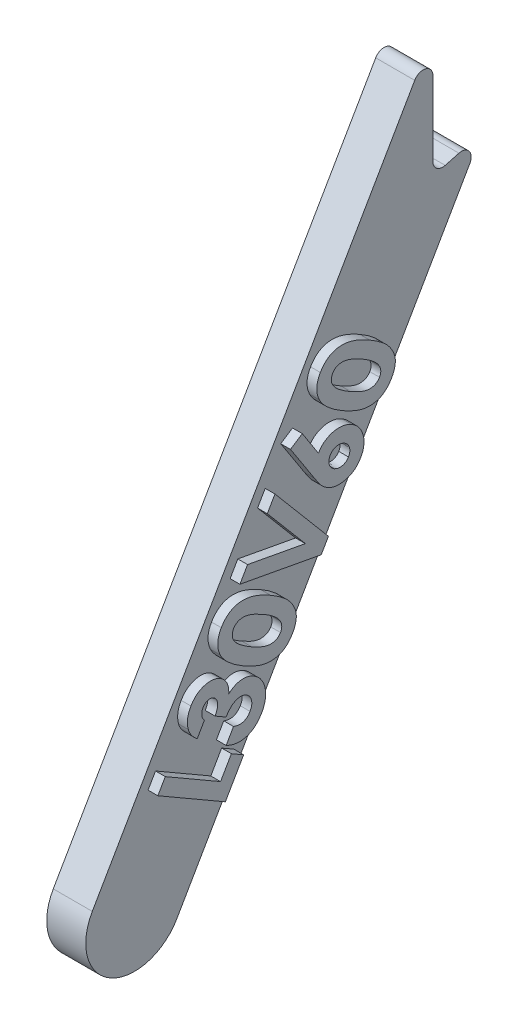
from build123d import *

# Parameters (mm, degrees)
BOSS_EXTRUDE1_DEPTH = 2
FILLET1_R           = 0.5
BOSS_EXTRUDE2_DEPTH = 0.5


with BuildPart() as part:
    # Sketch1 → Boss-Extrude1 (new body)
    with BuildSketch(Plane(origin=(0, 0, 0), x_dir=(0, 0, -1), z_dir=(1, 0, 0))):
        with BuildLine():
            Line((-2.165063509, 1.25), (15.297036272, 31.495244028))
            Line((15.297036272, 31.495244028), (15.297036272, 25.806989001))
            ThreePointArc((15.297036272, 25.806989001), (15.492655558, 25.410312331), (15.926445795, 25.324026088))
            Line((15.926445795, 25.324026088), (17.796953114, 25.825227013))
            Line((17.796953114, 25.825227013), (2.165063509, -1.25))
            ThreePointArc((2.165063509, -1.25), (-1.25, -2.165063509), (-2.165063509, 1.25))
        make_face()
    extrude(amount=BOSS_EXTRUDE1_DEPTH)

    # Fillet1
    fillet1_edges = [part.edges().sort_by_distance(p)[0] for p in [
        (1, 31.495244028, -15.297036272),
        (1, 25.825227013, -17.796953114),
    ]]
    fillet(fillet1_edges, radius=FILLET1_R)

    # Sketch2 → Boss-Extrude2 (add)
    # profile 1 of 6: a face of its own
    with BuildSketch(Plane(origin=(2, 0, 0), x_dir=(0, 0, -1), z_dir=(1, 0, 0))):
        Polygon((0.696036681, 5.202812128), (1.076645655, 5.861465975), (3.91078027, 4.224446744), (4.466068732, 5.185183923), (5.09427386, 4.822203154), (4.158376424, 3.202812128), align=None)
    # profile 2 of 6: a face of its own
    with BuildSketch(Plane(origin=(2, 0, 0), x_dir=(0, 0, -1), z_dir=(1, 0, 0))):
        with BuildLine():
            Line((3.081453347, 7.361009276), (2.716068732, 6.727996456))
            add(Edge.make_bspline(
                [(2.716068732, 6.727996456), (2.687395864, 6.750539351), (2.631081269, 6.794814449), (2.554308544, 6.867288344), (2.484888021, 6.942170767), (2.422950426, 7.019472666), (2.370112901, 7.100370796), (2.323683149, 7.18286105), (2.286667195, 7.269285762), (2.267927843, 7.328786726), (2.258536681, 7.35860543)],
                knots=[0, 0, 0, 0, 1.103452488, 2.167222367, 3.19120776, 4.192378773, 5.16097021, 6.112613477, 7.05414269, 8, 8, 8, 8], degree=3))
            add(Edge.make_bspline(
                [(2.258536681, 7.35860543), (2.24804942, 7.400365382), (2.227386734, 7.482643561), (2.211743441, 7.608133284), (2.207969235, 7.732747429), (2.219120269, 7.856432906), (2.240997268, 7.979734282), (2.278892765, 8.101129201), (2.327459355, 8.222861836), (2.369881131, 8.300512973), (2.391549501, 8.340175943)],
                knots=[0, 0, 0, 0, 1.013588041, 1.997037231, 2.972725098, 3.945242236, 4.917820447, 5.917146435, 6.936111432, 8, 8, 8, 8], degree=3))
            add(Edge.make_bspline(
                [(2.391549501, 8.340175943), (2.412317219, 8.374491348), (2.453230795, 8.442094632), (2.524053853, 8.535264546), (2.601419549, 8.618846221), (2.68395814, 8.69385256), (2.772911092, 8.759214724), (2.867562627, 8.815505579), (2.968634105, 8.862134091), (3.07406509, 8.899405848), (3.181698163, 8.926448983), (3.288427763, 8.943451759), (3.393359932, 8.95023658), (3.496060434, 8.945612891), (3.59668023, 8.929004317), (3.695397624, 8.902783721), (3.792151308, 8.865040514), (3.853404266, 8.832014733), (3.884337963, 8.815336199)],
                knots=[0, 0, 0, 0, 1.104545616, 2.17601713, 3.217554495, 4.238772093, 5.244036151, 6.253681051, 7.267741271, 8.305789213, 9.330262856, 10.321121269, 11.279587532, 12.22256057, 13.146856727, 14.084011555, 15.032396042, 16, 16, 16, 16], degree=3))
            add(Edge.make_bspline(
                [(3.884337963, 8.815336199), (3.921158498, 8.792079625), (3.994004027, 8.746068957), (4.089489226, 8.658893831), (4.170077627, 8.558638224), (4.236117514, 8.446338107), (4.286879341, 8.323477855), (4.319641819, 8.190387749), (4.335020956, 8.048575245), (4.331602387, 7.951575379), (4.329850783, 7.901874661)],
                knots=[0, 0, 0, 0, 0.971746073, 1.922496671, 2.873303474, 3.836562037, 4.82416312, 5.833158122, 6.889755202, 8, 8, 8, 8], degree=3))
            add(Edge.make_bspline(
                [(4.329850783, 7.901874661), (4.352791055, 7.922789366), (4.398123756, 7.964119306), (4.470286326, 8.019186463), (4.544109417, 8.067574828), (4.620010548, 8.108743324), (4.697786339, 8.143096812), (4.777437434, 8.171595687), (4.859282086, 8.192394363), (4.94270875, 8.205713754), (5.026543485, 8.213279093), (5.110144046, 8.212885682), (5.193351173, 8.207029755), (5.275506111, 8.192093091), (5.357318625, 8.171298432), (5.438388031, 8.142862622), (5.519354286, 8.108130269), (5.571272018, 8.079159), (5.597478988, 8.064534917)],
                knots=[0, 0, 0, 0, 1.081367641, 2.136910875, 3.159224907, 4.154618218, 5.142191382, 6.119535833, 7.09927064, 8.080110121, 9.060993763, 10.028986273, 10.990558503, 11.963772466, 12.934490777, 13.929405293, 14.954807702, 16, 16, 16, 16], degree=3))
            add(Edge.make_bspline(
                [(5.597478988, 8.064534917), (5.635139894, 8.041547436), (5.709184787, 7.996351879), (5.809996552, 7.915684829), (5.900887054, 7.827776512), (5.980743436, 7.731032589), (6.049148266, 7.626023535), (6.107054923, 7.513219345), (6.154536513, 7.392152343), (6.190806989, 7.264144846), (6.216089369, 7.13226796), (6.226081671, 6.998744286), (6.224034108, 6.865616949), (6.207697129, 6.732187937), (6.177601468, 6.599000757), (6.13514279, 6.465202392), (6.077881449, 6.331885316), (6.030875776, 6.245535286), (6.006934117, 6.201554148)],
                knots=[0, 0, 0, 0, 0.993515244, 1.953344675, 2.902602536, 3.839024727, 4.773975407, 5.721609641, 6.691858124, 7.699765937, 8.716264944, 9.712548052, 10.711935842, 11.712410712, 12.73615555, 13.785073901, 14.871859456, 16, 16, 16, 16], degree=3))
            add(Edge.make_bspline(
                [(6.006934117, 6.201554148), (5.982213617, 6.161056096), (5.933824189, 6.081782713), (5.851502595, 5.972387285), (5.763560608, 5.873890483), (5.668068859, 5.788088268), (5.568016078, 5.71173516), (5.460276831, 5.648524704), (5.347149089, 5.594957911), (5.227657689, 5.554533232), (5.104772254, 5.525658974), (4.979382399, 5.509409138), (4.8524025, 5.506403226), (4.723475959, 5.515828267), (4.59332375, 5.539931193), (4.46123732, 5.575064029), (4.327791366, 5.62420595), (4.240594017, 5.665850797), (4.196036681, 5.687131071)],
                knots=[0, 0, 0, 0, 1.082497812, 2.11894792, 3.120451818, 4.091599749, 5.045134628, 5.988263042, 6.937421913, 7.897580193, 8.861794763, 9.81462771, 10.778225281, 11.756447433, 12.759823874, 13.795053911, 14.873285434, 16, 16, 16, 16], degree=3))
            Line((4.196036681, 5.687131071), (4.573440527, 6.339374661))
            add(Edge.make_bspline(
                [(4.573440527, 6.339374661), (4.59735212, 6.330435346), (4.643614845, 6.313140094), (4.713469753, 6.294258484), (4.780439096, 6.279056022), (4.845428359, 6.27167041), (4.907565333, 6.267596655), (4.967425161, 6.2711851), (5.024932667, 6.279673639), (5.097715259, 6.299109352), (5.183518676, 6.336170603), (5.276260535, 6.400734528), (5.35790176, 6.484616226), (5.400204468, 6.551639896), (5.421998219, 6.586169533)],
                knots=[0, 0, 0, 0, 0.939597167, 1.817876585, 2.662916536, 3.465737634, 4.224184202, 4.953162039, 5.669621718, 6.361554499, 7.722932731, 9.087257403, 10.49939664, 12, 12, 12, 12], degree=3))
            add(Edge.make_bspline(
                [(5.421998219, 6.586169533), (5.441664647, 6.624268625), (5.479738039, 6.698026893), (5.510945142, 6.817233107), (5.51663471, 6.936992073), (5.500720443, 7.035560385), (5.477551816, 7.111694761), (5.455056295, 7.166047958), (5.428584348, 7.21740058), (5.396443524, 7.264628699), (5.359135048, 7.308177572), (5.317471444, 7.348404391), (5.270582518, 7.384735472), (5.236573764, 7.405655788), (5.21927386, 7.416297738)],
                knots=[0, 0, 0, 0, 1.615365577, 3.12728093, 4.611659855, 6.112397569, 6.871762481, 7.613506319, 8.330846268, 9.049815329, 9.765309206, 10.492928571, 11.233368272, 12, 12, 12, 12], degree=3))
            add(Edge.make_bspline(
                [(5.21927386, 7.416297738), (5.199720917, 7.426629643), (5.161026413, 7.447076077), (5.099704633, 7.4696573), (5.03691622, 7.483886894), (4.972696746, 7.491471777), (4.907000197, 7.490539699), (4.839924098, 7.481272275), (4.771421541, 7.465195306), (4.702040582, 7.441291257), (4.632914163, 7.408837432), (4.564576067, 7.368990355), (4.498533305, 7.319441625), (4.434611736, 7.261129222), (4.370931937, 7.19565876), (4.310209159, 7.120417408), (4.250879588, 7.03713654), (4.214119269, 6.977421978), (4.195235399, 6.946746456)],
                knots=[0, 0, 0, 0, 0.844174053, 1.670587152, 2.48736984, 3.298653107, 4.135394815, 4.989682768, 5.880657108, 6.819647913, 7.787413102, 8.793626458, 9.836422791, 10.934605363, 12.096405794, 13.321877204, 14.624241476, 16, 16, 16, 16], degree=3))
            Line((4.195235399, 6.946746456), (3.630331553, 7.272868251))
            add(Edge.make_bspline(
                [(3.630331553, 7.272868251), (3.648505471, 7.311894174), (3.682559775, 7.385020981), (3.722146838, 7.490781197), (3.748547324, 7.584022161), (3.762633517, 7.666601294), (3.763931391, 7.741250038), (3.757236354, 7.811168422), (3.739939032, 7.877058895), (3.71522021, 7.939162881), (3.682746578, 7.995553583), (3.643476608, 8.045267067), (3.598824993, 8.08875872), (3.563739622, 8.110536868), (3.546196937, 8.121425943)],
                knots=[0, 0, 0, 0, 1.635208655, 3.064055274, 4.285189192, 5.312893128, 6.23658106, 7.114072127, 7.973060155, 8.815402483, 9.647411949, 10.435105952, 11.217552976, 12, 12, 12, 12], degree=3))
            add(Edge.make_bspline(
                [(3.546196937, 8.121425943), (3.522842606, 8.133450686), (3.477462007, 8.156816377), (3.403142552, 8.173431316), (3.327996066, 8.175693961), (3.253493412, 8.159458862), (3.181652293, 8.130325472), (3.116794953, 8.084862232), (3.058186604, 8.026131812), (3.028183467, 7.978162631), (3.012543091, 7.953156712)],
                knots=[0, 0, 0, 0, 1.002389715, 1.947777773, 2.889117042, 3.86011462, 4.846084409, 5.839192295, 6.87358967, 8, 8, 8, 8], degree=3))
            add(Edge.make_bspline(
                [(3.012543091, 7.953156712), (3.00028504, 7.929457908), (2.975973322, 7.882455438), (2.953211717, 7.80601618), (2.944956232, 7.726596398), (2.947816851, 7.646038071), (2.963884654, 7.567099997), (2.991590235, 7.492364004), (3.029922859, 7.422352014), (3.064165452, 7.38158907), (3.081453347, 7.361009276)],
                knots=[0, 0, 0, 0, 1.003070024, 1.989415536, 2.981129302, 3.997619589, 5.013313644, 5.999659156, 6.990097405, 8, 8, 8, 8], degree=3))
        make_face()
    # profile 3 of 6: a face of its own
    with BuildSketch(Plane(origin=(2, 0, 0), x_dir=(0, 0, -1), z_dir=(1, 0, 0))):
        with BuildLine():
            add(Edge.make_bspline(
                [(3.948440527, 11.037261821), (3.967070964, 11.067918482), (4.003714257, 11.128215562), (4.063605599, 11.213791467), (4.129328019, 11.291234519), (4.196912463, 11.364177436), (4.270039996, 11.428817957), (4.346887328, 11.486829964), (4.426767017, 11.539350801), (4.51151078, 11.584026741), (4.599557408, 11.623066815), (4.692071927, 11.653041773), (4.788100918, 11.676885258), (4.888208508, 11.691543692), (4.992085658, 11.699645077), (5.099708052, 11.700223282), (5.211340252, 11.693853785), (5.327277028, 11.679292829), (5.448508993, 11.655661316), (5.57578543, 11.62250217), (5.710261931, 11.579999306), (5.850803949, 11.525743329), (5.998309625, 11.462325533), (6.1523397, 11.389255459), (6.312875517, 11.305692443), (6.420857496, 11.244345849), (6.476485399, 11.212742591)],
                knots=[0, 0, 0, 0, 0.897945687, 1.766125294, 2.611054601, 3.438745458, 4.253288671, 5.050272801, 5.847705525, 6.643342353, 7.445776631, 8.255558727, 9.074480649, 9.919833108, 10.784917775, 11.680869907, 12.611765167, 13.582045211, 14.603519984, 15.701372416, 16.872820259, 18.131942509, 19.470767641, 20.891370698, 22.39856122, 24, 24, 24, 24], degree=3))
            add(Edge.make_bspline(
                [(6.476485399, 11.212742591), (6.532289502, 11.18002821), (6.640639838, 11.116509331), (6.794306383, 11.017351378), (6.936830323, 10.92106389), (7.065875811, 10.823787014), (7.183151997, 10.727753211), (7.288424129, 10.632703576), (7.381009592, 10.53794593), (7.461615205, 10.443792102), (7.531687583, 10.349989963), (7.593636711, 10.257396942), (7.646655614, 10.16450623), (7.692612359, 10.072787257), (7.730014554, 9.980997422), (7.757575166, 9.889314431), (7.779279122, 9.7984966), (7.791017001, 9.707468847), (7.795175111, 9.616324518), (7.790996002, 9.524369517), (7.77902846, 9.431613647), (7.758604387, 9.337899333), (7.730498204, 9.243352338), (7.694154631, 9.147455205), (7.649411411, 9.050935238), (7.614428921, 8.987646001), (7.596677706, 8.955531052)],
                knots=[0, 0, 0, 0, 1.627138575, 3.159284035, 4.599955029, 5.953233711, 7.223102846, 8.412295733, 9.519440672, 10.553632078, 11.527938494, 12.463474405, 13.35441623, 14.216852656, 15.042868795, 15.844164156, 16.623290634, 17.389238113, 18.149268111, 18.916010952, 19.701945684, 20.499287075, 21.326313799, 22.181178389, 23.077072736, 24, 24, 24, 24], degree=3))
            add(Edge.make_bspline(
                [(7.596677706, 8.955531052), (7.577551297, 8.923779074), (7.540221278, 8.86180707), (7.478793185, 8.77420795), (7.413392725, 8.69469319), (7.344790925, 8.621623269), (7.272711226, 8.556381932), (7.198117222, 8.496594529), (7.118263131, 8.446983341), (7.036321823, 8.40201113), (6.95035796, 8.365311521), (6.860526977, 8.335562246), (6.767149073, 8.312066347), (6.669447141, 8.297290501), (6.568553998, 8.288609772), (6.463596602, 8.285751394), (6.354992816, 8.292181008), (6.241681128, 8.303770968), (6.123000069, 8.324934475), (5.998059784, 8.356484146), (5.866253331, 8.398522109), (5.727597792, 8.451353411), (5.580858944, 8.51245937), (5.428297547, 8.5861837), (5.267899559, 8.668672643), (5.16028854, 8.72995752), (5.104690527, 8.761620796)],
                knots=[0, 0, 0, 0, 0.938650759, 1.832013983, 2.706846486, 3.544289129, 4.367929325, 5.167721864, 5.961541433, 6.745470318, 7.53335876, 8.32486903, 9.140300817, 9.968871211, 10.824477765, 11.704135634, 12.625366009, 13.57785821, 14.587718162, 15.675505246, 16.839365094, 18.089553933, 19.432634678, 20.863865142, 22.379693198, 24, 24, 24, 24], degree=3))
            add(Edge.make_bspline(
                [(5.104690527, 8.761620796), (5.028437458, 8.806914173), (4.881290076, 8.894317893), (4.674940898, 9.031158142), (4.490688628, 9.168471421), (4.32771187, 9.304866908), (4.186289039, 9.441280917), (4.067048617, 9.577779623), (3.968086633, 9.713671493), (3.918030231, 9.808808892), (3.893953347, 9.854569514)],
                knots=[0, 0, 0, 0, 1.287312753, 2.484158368, 3.592255041, 4.621348856, 5.567290122, 6.44119351, 7.250221727, 8, 8, 8, 8], degree=3))
            add(Edge.make_bspline(
                [(3.893953347, 9.854569514), (3.872471542, 9.904069487), (3.830436129, 10.000930609), (3.788519695, 10.151197824), (3.76689947, 10.300902864), (3.762948993, 10.450131908), (3.780755353, 10.598933407), (3.815995021, 10.747343177), (3.871628899, 10.89513928), (3.922463473, 10.989197159), (3.948440527, 11.037261821)],
                knots=[0, 0, 0, 0, 1.047685645, 2.05010224, 3.020483215, 3.980916167, 4.942134176, 5.92407839, 6.939180083, 8, 8, 8, 8], degree=3))
        make_face()
        with BuildLine():
            add(Edge.make_bspline(
                [(4.584658476, 10.691909257), (4.570324139, 10.664017166), (4.542012103, 10.608926937), (4.516836478, 10.519258986), (4.50924412, 10.426439381), (4.516776108, 10.330378236), (4.545989961, 10.230623591), (4.600101652, 10.129195702), (4.677064581, 10.024441207), (4.758342428, 9.936924908), (4.835983746, 9.86422478), (4.905349645, 9.806985846), (4.982466411, 9.746363282), (5.069133126, 9.68429987), (5.164494272, 9.619346216), (5.268695264, 9.552461582), (5.380885499, 9.482101227), (5.459772261, 9.436579089), (5.50052386, 9.413063103)],
                knots=[0, 0, 0, 0, 0.858098385, 1.6948473, 2.532716597, 3.399764107, 4.321997128, 5.360041158, 6.534607272, 7.876701611, 8.627836606, 9.449033435, 10.34097936, 11.316376895, 12.370333617, 13.503553264, 14.710376797, 16, 16, 16, 16], degree=3))
            add(Edge.make_bspline(
                [(5.50052386, 9.413063103), (5.553447726, 9.382997679), (5.65488074, 9.325374779), (5.804405816, 9.24910927), (5.943791012, 9.184568871), (6.073457075, 9.132260268), (6.193187852, 9.091612003), (6.303113362, 9.062759695), (6.403833205, 9.046903563), (6.495549335, 9.043586187), (6.579092149, 9.050003568), (6.655643229, 9.064401543), (6.725974657, 9.085868784), (6.789992518, 9.115088963), (6.848460618, 9.151075638), (6.899951897, 9.195758455), (6.945574056, 9.247544486), (6.970317821, 9.28662636), (6.982895655, 9.306492591)],
                knots=[0, 0, 0, 0, 1.768942212, 3.390325707, 4.877044807, 6.232131372, 7.452230754, 8.549941164, 9.531480804, 10.409266107, 11.211278712, 11.961899381, 12.669070726, 13.343035498, 14.002172135, 14.65727339, 15.317460663, 16, 16, 16, 16], degree=3))
            add(Edge.make_bspline(
                [(6.982895655, 9.306492591), (6.993641265, 9.326518284), (7.014664644, 9.365697795), (7.035686576, 9.428441551), (7.046853244, 9.492192815), (7.049214794, 9.557152314), (7.042879012, 9.623267825), (7.026258884, 9.690508777), (7.000554619, 9.75877432), (6.977251145, 9.802987139), (6.96526745, 9.82572336)],
                knots=[0, 0, 0, 0, 0.9977922, 1.952142726, 2.894277992, 3.83436195, 4.801842901, 5.804391607, 6.870919352, 8, 8, 8, 8], degree=3))
            add(Edge.make_bspline(
                [(6.96526745, 9.82572336), (6.947691095, 9.854437092), (6.910650519, 9.914948682), (6.839987435, 10.001856049), (6.754323918, 10.089772232), (6.654454685, 10.180012679), (6.53838714, 10.270803385), (6.40809558, 10.364339362), (6.262396812, 10.459287698), (6.158644382, 10.520074331), (6.104690527, 10.551684898)],
                knots=[0, 0, 0, 0, 0.709639423, 1.495500801, 2.356295037, 3.297846039, 4.332767012, 5.463375497, 6.680891909, 8, 8, 8, 8], degree=3))
            add(Edge.make_bspline(
                [(6.104690527, 10.551684898), (6.049876568, 10.582776776), (5.944353811, 10.642631978), (5.789366493, 10.722654923), (5.644718126, 10.790156726), (5.511091755, 10.846696085), (5.386673624, 10.887776256), (5.273584217, 10.919428434), (5.170540039, 10.93788424), (5.077145491, 10.942805485), (4.992413088, 10.937553293), (4.914558088, 10.926374556), (4.843179577, 10.905768691), (4.777756657, 10.879123968), (4.719375958, 10.843250215), (4.667701783, 10.800066099), (4.620879326, 10.750497869), (4.596840647, 10.711614386), (4.584658476, 10.691909257)],
                knots=[0, 0, 0, 0, 1.790751456, 3.447388827, 4.955093698, 6.326611356, 7.567552449, 8.675972391, 9.661778731, 10.53585222, 11.326557617, 12.071569383, 12.76594841, 13.432730707, 14.073202204, 14.703929538, 15.343185505, 16, 16, 16, 16], degree=3))
        make_face(mode=Mode.SUBTRACT)
    # profile 4 of 6: a face of its own
    with BuildSketch(Plane(origin=(2, 0, 0), x_dir=(0, 0, -1), z_dir=(1, 0, 0))):
        Polygon((4.90276745, 12.489155392), (5.294594373, 13.167040008), (8.256934117, 12.616559238), (6.307414886, 14.920245136), (6.698440527, 15.598129751), (9.440427706, 12.350533597), (9.073440527, 11.715116931), align=None)
    # profile 5 of 6: a face of its own
    with BuildSketch(Plane(origin=(2, 0, 0), x_dir=(0, 0, -1), z_dir=(1, 0, 0))):
        with BuildLine():
            Line((7.495716168, 17.180940299), (8.099882835, 17.578376197))
            Line((8.099882835, 17.578376197), (8.926805911, 16.293921068))
            add(Edge.make_bspline(
                [(8.926805911, 16.293921068), (8.948502177, 16.329419855), (8.991341141, 16.399511697), (9.067602636, 16.494499794), (9.149203663, 16.581399771), (9.239844288, 16.657098591), (9.337848575, 16.722694495), (9.442883318, 16.779389086), (9.555348311, 16.825943193), (9.674413325, 16.861342318), (9.796277362, 16.887268521), (9.919261527, 16.899963363), (10.04116026, 16.901190597), (10.16245596, 16.888654214), (10.282733688, 16.864736861), (10.402331136, 16.828062396), (10.521296997, 16.779639036), (10.597337596, 16.737559099), (10.635940527, 16.716196709)],
                knots=[0, 0, 0, 0, 1.016770061, 2.007597834, 2.973466577, 3.928825203, 4.889264375, 5.853961147, 6.844077761, 7.861036741, 8.888727441, 9.88734454, 10.880496183, 11.865446955, 12.864918668, 13.875624691, 14.921535175, 16, 16, 16, 16], degree=3))
            add(Edge.make_bspline(
                [(10.635940527, 16.716196709), (10.672475405, 16.693934524), (10.744303427, 16.650166792), (10.842633997, 16.573073884), (10.931152148, 16.488990536), (11.009234138, 16.396893561), (11.077845828, 16.298092241), (11.135737371, 16.191290272), (11.184031944, 16.077308301), (11.220728534, 15.95709136), (11.248582015, 15.834536514), (11.262750299, 15.711784028), (11.265425208, 15.590750592), (11.255656343, 15.471289948), (11.234092828, 15.353388021), (11.199933289, 15.236913267), (11.153776927, 15.122099625), (11.113726879, 15.048892462), (11.093472578, 15.011869786)],
                knots=[0, 0, 0, 0, 1.045088116, 2.054656118, 3.047533785, 4.024832539, 5.001018359, 5.982734527, 6.989236529, 8.021788017, 9.051486862, 10.057332162, 11.036896513, 12.006377891, 12.982214293, 13.96158279, 14.969121932, 16, 16, 16, 16], degree=3))
            add(Edge.make_bspline(
                [(11.093472578, 15.011869786), (11.07042136, 14.973997734), (11.025190146, 14.899685003), (10.946045481, 14.798028288), (10.858985036, 14.708187901), (10.765525466, 14.627856099), (10.664241184, 14.558751868), (10.555048391, 14.500738246), (10.438792928, 14.453468185), (10.316775974, 14.417938739), (10.192844452, 14.393348155), (10.070079673, 14.379593062), (9.949570053, 14.376628816), (9.831903096, 14.386921163), (9.716321935, 14.405931375), (9.604495947, 14.440356824), (9.493925684, 14.482431034), (9.424273562, 14.520643052), (9.389145655, 14.539914658)],
                knots=[0, 0, 0, 0, 1.082562769, 2.124210071, 3.139524217, 4.134695484, 5.130187625, 6.128605648, 7.150149928, 8.190856544, 9.228756496, 10.233318689, 11.205831343, 12.168286628, 13.115601749, 14.061297219, 15.022247006, 16, 16, 16, 16], degree=3))
            add(Edge.make_bspline(
                [(9.389145655, 14.539914658), (9.362645438, 14.555721247), (9.309239417, 14.587576345), (9.234755944, 14.644484263), (9.161645696, 14.705297266), (9.103784178, 14.762660877), (9.057315913, 14.814736221), (9.018442052, 14.860651107), (8.977321023, 14.914074991), (8.933139852, 14.974762434), (8.885048046, 15.041878014), (8.833742945, 15.116224177), (8.780257423, 15.198451894), (8.743304194, 15.255454743), (8.724081553, 15.285106966)],
                knots=[0, 0, 0, 0, 1.099366985, 2.2155598, 3.337426422, 4.48901572, 5.11621246, 5.825909377, 6.633635468, 7.519397653, 8.502516875, 9.577691488, 10.739943151, 12, 12, 12, 12], degree=3))
            Line((8.724081553, 15.285106966), (7.495716168, 17.180940299))
        make_face()
        with BuildLine():
            add(Edge.make_bspline(
                [(9.528568732, 15.896485171), (9.513027116, 15.866045588), (9.48261531, 15.806481469), (9.461092402, 15.708768922), (9.460333244, 15.609161251), (9.480800565, 15.509858407), (9.519462556, 15.414411352), (9.578020956, 15.328944173), (9.652894144, 15.253232263), (9.713594728, 15.214531059), (9.744914886, 15.194562094)],
                knots=[0, 0, 0, 0, 0.998029555, 1.95294236, 2.899869512, 3.897438757, 4.904539134, 5.896444523, 6.914611937, 8, 8, 8, 8], degree=3))
            add(Edge.make_bspline(
                [(9.744914886, 15.194562094), (9.778017867, 15.177464812), (9.842341319, 15.144242543), (9.94688504, 15.11748846), (10.052567825, 15.111658259), (10.157096714, 15.127438321), (10.255425963, 15.160069663), (10.342299576, 15.20988347), (10.41620702, 15.27470857), (10.45147988, 15.329021837), (10.46927386, 15.356421068)],
                knots=[0, 0, 0, 0, 1.083116987, 2.104638916, 3.118149719, 4.148650156, 5.167855638, 6.119946921, 7.051575955, 8, 8, 8, 8], degree=3))
            add(Edge.make_bspline(
                [(10.46927386, 15.356421068), (10.484748174, 15.387152354), (10.515067784, 15.447365724), (10.537722846, 15.546431837), (10.539216847, 15.648223195), (10.519158455, 15.750167054), (10.482513389, 15.849193496), (10.424323045, 15.938266366), (10.348328854, 16.016671817), (10.286438307, 16.056328431), (10.25453027, 16.076773633)],
                knots=[0, 0, 0, 0, 0.984308747, 1.928606143, 2.886640954, 3.884636536, 4.893692361, 5.896999199, 6.915785555, 8, 8, 8, 8], degree=3))
            add(Edge.make_bspline(
                [(10.25453027, 16.076773633), (10.221702226, 16.093887361), (10.157710305, 16.127247263), (10.054134903, 16.153614312), (9.949823035, 16.15967776), (9.847015299, 16.143980989), (9.749300426, 16.110427664), (9.66201082, 16.056426319), (9.585948463, 15.985400927), (9.547957742, 15.926530423), (9.528568732, 15.896485171)],
                knots=[0, 0, 0, 0, 1.061006374, 2.068226646, 3.044554145, 4.045436683, 5.038369836, 5.99281701, 6.975610623, 8, 8, 8, 8], degree=3))
        make_face(mode=Mode.SUBTRACT)
    # profile 6 of 6: a face of its own
    with BuildSketch(Plane(origin=(2, 0, 0), x_dir=(0, 0, -1), z_dir=(1, 0, 0))):
        with BuildLine():
            add(Edge.make_bspline(
                [(9.025363604, 19.830750537), (9.043994041, 19.861407197), (9.080637334, 19.921704278), (9.140528676, 20.007280182), (9.206251096, 20.084723234), (9.27383554, 20.157666151), (9.346963073, 20.222306672), (9.423810404, 20.28031868), (9.503690094, 20.332839516), (9.588433857, 20.377515456), (9.676480485, 20.416555531), (9.768995004, 20.446530488), (9.865023995, 20.470373973), (9.965131584, 20.485032407), (10.069008735, 20.493133792), (10.176631129, 20.493711997), (10.288263329, 20.487342501), (10.404200105, 20.472781545), (10.52543207, 20.449150031), (10.652708507, 20.415990886), (10.787185008, 20.373488021), (10.927727026, 20.319232044), (11.075232702, 20.255814248), (11.229262777, 20.182744175), (11.389798593, 20.099181158), (11.497780573, 20.037834564), (11.553408476, 20.006231306)],
                knots=[0, 0, 0, 0, 0.897945687, 1.766125294, 2.611054601, 3.438745458, 4.253288671, 5.050272801, 5.847705525, 6.643342353, 7.445776631, 8.255558727, 9.074480649, 9.919833108, 10.784917775, 11.680869907, 12.611765167, 13.582045211, 14.603519984, 15.701372416, 16.872820259, 18.131942509, 19.470767641, 20.891370698, 22.39856122, 24, 24, 24, 24], degree=3))
            add(Edge.make_bspline(
                [(11.553408476, 20.006231306), (11.609212579, 19.973516926), (11.717562915, 19.909998046), (11.87122946, 19.810840093), (12.0137534, 19.714552605), (12.142798888, 19.617275729), (12.260075074, 19.521241926), (12.365347206, 19.426192291), (12.457932669, 19.331434646), (12.538538282, 19.237280818), (12.60861066, 19.143478678), (12.670559788, 19.050885658), (12.723578691, 18.957994946), (12.769535436, 18.866275973), (12.806937631, 18.774486138), (12.834498243, 18.682803146), (12.856202199, 18.591985315), (12.867940078, 18.500957562), (12.872098188, 18.409813233), (12.867919079, 18.317858232), (12.855951537, 18.225102362), (12.835527464, 18.131388049), (12.807421281, 18.036841053), (12.771077707, 17.94094392), (12.726334488, 17.844423953), (12.691351998, 17.781134716), (12.673600783, 17.749019767)],
                knots=[0, 0, 0, 0, 1.627138575, 3.159284035, 4.599955029, 5.953233711, 7.223102846, 8.412295733, 9.519440672, 10.553632078, 11.527938494, 12.463474405, 13.35441623, 14.216852656, 15.042868795, 15.844164156, 16.623290634, 17.389238113, 18.149268111, 18.916010952, 19.701945684, 20.499287075, 21.326313799, 22.181178389, 23.077072736, 24, 24, 24, 24], degree=3))
            add(Edge.make_bspline(
                [(12.673600783, 17.749019767), (12.654474374, 17.717267789), (12.617144355, 17.655295785), (12.555716261, 17.567696665), (12.490315802, 17.488181906), (12.421714002, 17.415111984), (12.349634303, 17.349870647), (12.275040299, 17.290083244), (12.195186208, 17.240472057), (12.1132449, 17.195499846), (12.027281037, 17.158800237), (11.937450054, 17.129050961), (11.84407215, 17.105555062), (11.746370218, 17.090779217), (11.645477075, 17.082098487), (11.540519679, 17.079240109), (11.431915893, 17.085669724), (11.318604205, 17.097259684), (11.199923146, 17.118423191), (11.074982861, 17.149972861), (10.943176408, 17.192010824), (10.804520869, 17.244842126), (10.657782021, 17.305948086), (10.505220624, 17.379672415), (10.344822636, 17.462161358), (10.237211617, 17.523446235), (10.181613604, 17.555109511)],
                knots=[0, 0, 0, 0, 0.938650759, 1.832013983, 2.706846486, 3.544289129, 4.367929325, 5.167721864, 5.961541433, 6.745470318, 7.53335876, 8.32486903, 9.140300817, 9.968871211, 10.824477765, 11.704135634, 12.625366009, 13.57785821, 14.587718162, 15.675505246, 16.839365094, 18.089553933, 19.432634678, 20.863865142, 22.379693198, 24, 24, 24, 24], degree=3))
            add(Edge.make_bspline(
                [(10.181613604, 17.555109511), (10.105360534, 17.600402889), (9.958213153, 17.687806608), (9.751863975, 17.824646858), (9.567611705, 17.961960137), (9.404634947, 18.098355623), (9.263212116, 18.234769632), (9.143971694, 18.371268338), (9.045009709, 18.507160208), (8.994953308, 18.602297607), (8.970876424, 18.648058229)],
                knots=[0, 0, 0, 0, 1.287312753, 2.484158368, 3.592255041, 4.621348856, 5.567290122, 6.44119351, 7.250221727, 8, 8, 8, 8], degree=3))
            add(Edge.make_bspline(
                [(8.970876424, 18.648058229), (8.949394618, 18.697558202), (8.907359206, 18.794419324), (8.865442772, 18.944686539), (8.843822547, 19.094391579), (8.839872069, 19.243620624), (8.85767843, 19.392422122), (8.892918097, 19.540831892), (8.948551976, 19.688627996), (8.999386549, 19.782685874), (9.025363604, 19.830750537)],
                knots=[0, 0, 0, 0, 1.047685645, 2.05010224, 3.020483215, 3.980916167, 4.942134176, 5.92407839, 6.939180083, 8, 8, 8, 8], degree=3))
        make_face()
        with BuildLine():
            add(Edge.make_bspline(
                [(9.661581553, 19.485397973), (9.647247216, 19.457505881), (9.61893518, 19.402415653), (9.593759555, 19.312747701), (9.586167197, 19.219928096), (9.593699185, 19.123866951), (9.622913038, 19.024112306), (9.677024729, 18.922684417), (9.753987658, 18.817929923), (9.835265505, 18.730413624), (9.912906823, 18.657713495), (9.982272722, 18.600474561), (10.059389488, 18.539851998), (10.146056203, 18.477788586), (10.241417348, 18.412834931), (10.345618341, 18.345950298), (10.457808576, 18.275589942), (10.536695338, 18.230067804), (10.577446937, 18.206551819)],
                knots=[0, 0, 0, 0, 0.858098385, 1.6948473, 2.532716597, 3.399764107, 4.321997128, 5.360041158, 6.534607272, 7.876701611, 8.627836606, 9.449033435, 10.34097936, 11.316376895, 12.370333617, 13.503553264, 14.710376797, 16, 16, 16, 16], degree=3))
            add(Edge.make_bspline(
                [(10.577446937, 18.206551819), (10.630370802, 18.176486394), (10.731803817, 18.118863494), (10.881328893, 18.042597985), (11.020714089, 17.978057586), (11.150380152, 17.925748983), (11.270110929, 17.885100718), (11.380036439, 17.85624841), (11.480756282, 17.840392278), (11.572472412, 17.837074902), (11.656015226, 17.843492283), (11.732566305, 17.857890258), (11.802897734, 17.879357499), (11.866915595, 17.908577678), (11.925383695, 17.944564353), (11.976874974, 17.989247171), (12.022497133, 18.041033201), (12.047240898, 18.080115075), (12.059818732, 18.099981306)],
                knots=[0, 0, 0, 0, 1.768942212, 3.390325707, 4.877044807, 6.232131372, 7.452230754, 8.549941164, 9.531480804, 10.409266107, 11.211278712, 11.961899381, 12.669070726, 13.343035498, 14.002172135, 14.65727339, 15.317460663, 16, 16, 16, 16], degree=3))
            add(Edge.make_bspline(
                [(12.059818732, 18.099981306), (12.070564342, 18.120006999), (12.091587721, 18.159186511), (12.112609653, 18.221930266), (12.123776321, 18.28568153), (12.126137871, 18.350641029), (12.119802089, 18.41675654), (12.103181961, 18.483997492), (12.077477695, 18.552263035), (12.054174222, 18.596475854), (12.042190527, 18.619212075)],
                knots=[0, 0, 0, 0, 0.9977922, 1.952142726, 2.894277992, 3.83436195, 4.801842901, 5.804391607, 6.870919352, 8, 8, 8, 8], degree=3))
            add(Edge.make_bspline(
                [(12.042190527, 18.619212075), (12.024614172, 18.647925808), (11.987573596, 18.708437398), (11.916910511, 18.795344764), (11.831246995, 18.883260947), (11.731377762, 18.973501395), (11.615310217, 19.064292101), (11.485018657, 19.157828078), (11.339319889, 19.252776413), (11.235567459, 19.313563046), (11.181613604, 19.345173614)],
                knots=[0, 0, 0, 0, 0.709639423, 1.495500801, 2.356295037, 3.297846039, 4.332767012, 5.463375497, 6.680891909, 8, 8, 8, 8], degree=3))
            add(Edge.make_bspline(
                [(11.181613604, 19.345173614), (11.126799645, 19.376265491), (11.021276888, 19.436120693), (10.86628957, 19.516143638), (10.721641202, 19.583645442), (10.588014832, 19.6401848), (10.463596701, 19.681264971), (10.350507294, 19.71291715), (10.247463116, 19.731372955), (10.154068567, 19.7362942), (10.069336165, 19.731042009), (9.991481165, 19.719863271), (9.920102654, 19.699257406), (9.854679734, 19.672612683), (9.796299035, 19.636738931), (9.74462486, 19.593554814), (9.697802403, 19.543986584), (9.673763724, 19.505103101), (9.661581553, 19.485397973)],
                knots=[0, 0, 0, 0, 1.790751456, 3.447388827, 4.955093698, 6.326611356, 7.567552449, 8.675972391, 9.661778731, 10.53585222, 11.326557617, 12.071569383, 12.76594841, 13.432730707, 14.073202204, 14.703929538, 15.343185505, 16, 16, 16, 16], degree=3))
        make_face(mode=Mode.SUBTRACT)
    extrude(amount=BOSS_EXTRUDE2_DEPTH)


solid = part.part
